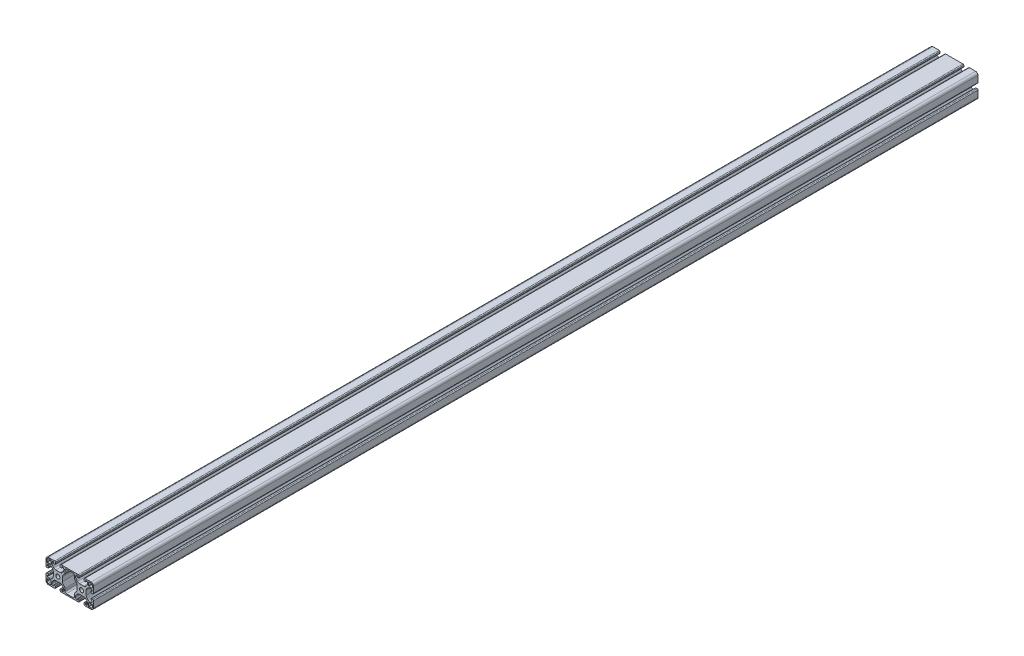
from build123d import *

# Parameters (mm, degrees)
ESQUISSE1_R        = 3.4
BOSS_EXTRU_1_DEPTH = 1492


with BuildPart() as part:
    # Esquisse1 → Boss.-Extru.1 (new body)
    with BuildSketch(Plane.XY.offset(20)):
        with BuildLine():
            Line((66.5, 4.5), (65, 4.5))
            ThreePointArc((65, 4.5), (64.292893219, 4.207106781), (64, 3.5))
            Line((64, 3.5), (64, 1.5))
            ThreePointArc((64, 1.5), (64.439339828, 0.439339828), (65.5, 0))
            Line((65.5, 0), (76, 0))
            ThreePointArc((76, 0), (78.828427125, 1.171572875), (80, 4))
            Line((80, 4), (80, 14.5))
            ThreePointArc((80, 14.5), (79.560660172, 15.560660172), (78.5, 16))
            Line((78.5, 16), (76.5, 16))
            ThreePointArc((76.5, 16), (75.792893219, 15.707106781), (75.5, 15))
            Line((75.5, 15), (75.5, 13.5))
            ThreePointArc((75.5, 13.5), (75.646446609, 13.146446609), (76, 13))
            Line((76, 13), (77.5, 13))
            ThreePointArc((77.5, 13), (77.853553391, 12.853553391), (78, 12.5))
            ThreePointArc((78, 12.5), (77.267766953, 10.732233047), (75.5, 10))
            Line((75.5, 10), (74.192388155, 10))
            ThreePointArc((74.192388155, 10), (72.278970994, 10.380602337), (70.656854249, 11.464466094))
            Line((70.656854249, 11.464466094), (69.214466094, 12.906854249))
            ThreePointArc((69.214466094, 12.906854249), (68.130602337, 14.528970994), (67.75, 16.442388155))
            Line((67.75, 16.442388155), (67.75, 23.557611845))
            ThreePointArc((67.75, 23.557611845), (68.130602337, 25.471029006), (69.214466094, 27.093145751))
            Line((69.214466094, 27.093145751), (70.656854249, 28.535533906))
            ThreePointArc((70.656854249, 28.535533906), (72.278970994, 29.619397663), (74.192388155, 30))
            Line((74.192388155, 30), (75.5, 30))
            ThreePointArc((75.5, 30), (77.267766953, 29.267766953), (78, 27.5))
            ThreePointArc((78, 27.5), (77.853553391, 27.146446609), (77.5, 27))
            Line((77.5, 27), (76, 27))
            ThreePointArc((76, 27), (75.646446609, 26.853553391), (75.5, 26.5))
            Line((75.5, 26.5), (75.5, 25))
            ThreePointArc((75.5, 25), (75.792893219, 24.292893219), (76.5, 24))
            Line((76.5, 24), (78.5, 24))
            ThreePointArc((78.5, 24), (79.560660172, 24.439339828), (80, 25.5))
            Line((80, 25.5), (80, 36))
            ThreePointArc((80, 36), (78.828427125, 38.828427125), (76, 40))
            Line((76, 40), (65.5, 40))
            ThreePointArc((65.5, 40), (64.439339828, 39.560660172), (64, 38.5))
            Line((64, 38.5), (64, 36.5))
            ThreePointArc((64, 36.5), (64.292893219, 35.792893219), (65, 35.5))
            Line((65, 35.5), (66.5, 35.5))
            ThreePointArc((66.5, 35.5), (66.853553391, 35.646446609), (67, 36))
            Line((67, 36), (67, 37.5))
            ThreePointArc((67, 37.5), (67.146446609, 37.853553391), (67.5, 38))
            ThreePointArc((67.5, 38), (69.267766953, 37.267766953), (70, 35.5))
            Line((70, 35.5), (70, 34.192388155))
            ThreePointArc((70, 34.192388155), (69.619397663, 32.278970994), (68.535533906, 30.656854249))
            Line((68.535533906, 30.656854249), (67.093145751, 29.214466094))
            ThreePointArc((67.093145751, 29.214466094), (65.471029006, 28.130602337), (63.557611845, 27.75))
            Line((63.557611845, 27.75), (56.442388155, 27.75))
            ThreePointArc((56.442388155, 27.75), (54.528970994, 28.130602337), (52.906854249, 29.214466094))
            Line((52.906854249, 29.214466094), (51.464466094, 30.656854249))
            ThreePointArc((51.464466094, 30.656854249), (50.380602337, 32.278970994), (50, 34.192388155))
            Line((50, 34.192388155), (50, 35.5))
            ThreePointArc((50, 35.5), (50.732233047, 37.267766953), (52.5, 38))
            ThreePointArc((52.5, 38), (52.853553391, 37.853553391), (53, 37.5))
            Line((53, 37.5), (53, 36))
            ThreePointArc((53, 36), (53.146446609, 35.646446609), (53.5, 35.5))
            Line((53.5, 35.5), (55, 35.5))
            ThreePointArc((55, 35.5), (55.707106781, 35.792893219), (56, 36.5))
            Line((56, 36.5), (56, 38.5))
            ThreePointArc((56, 38.5), (55.560660172, 39.560660172), (54.5, 40))
            Line((54.5, 40), (25.5, 40))
            ThreePointArc((25.5, 40), (24.439339828, 39.560660172), (24, 38.5))
            Line((24, 38.5), (24, 36.5))
            ThreePointArc((24, 36.5), (24.292893219, 35.792893219), (25, 35.5))
            Line((25, 35.5), (26.5, 35.5))
            ThreePointArc((26.5, 35.5), (26.853553391, 35.646446609), (27, 36))
            Line((27, 36), (27, 37.5))
            ThreePointArc((27, 37.5), (27.146446609, 37.853553391), (27.5, 38))
            ThreePointArc((27.5, 38), (29.267766953, 37.267766953), (30, 35.5))
            Line((30, 35.5), (30, 34.192388155))
            ThreePointArc((30, 34.192388155), (29.619397663, 32.278970994), (28.535533906, 30.656854249))
            Line((28.535533906, 30.656854249), (27.093145751, 29.214466094))
            ThreePointArc((27.093145751, 29.214466094), (25.471029006, 28.130602337), (23.557611845, 27.75))
            Line((23.557611845, 27.75), (16.442388155, 27.75))
            ThreePointArc((16.442388155, 27.75), (14.528970994, 28.130602337), (12.906854249, 29.214466094))
            Line((12.906854249, 29.214466094), (11.464466094, 30.656854249))
            ThreePointArc((11.464466094, 30.656854249), (10.380602337, 32.278970994), (10, 34.192388155))
            Line((10, 34.192388155), (10, 35.5))
            ThreePointArc((10, 35.5), (10.732233047, 37.267766953), (12.5, 38))
            ThreePointArc((12.5, 38), (12.853553391, 37.853553391), (13, 37.5))
            Line((13, 37.5), (13, 36))
            ThreePointArc((13, 36), (13.146446609, 35.646446609), (13.5, 35.5))
            Line((13.5, 35.5), (15, 35.5))
            ThreePointArc((15, 35.5), (15.707106781, 35.792893219), (16, 36.5))
            Line((16, 36.5), (16, 38.5))
            ThreePointArc((16, 38.5), (15.560660172, 39.560660172), (14.5, 40))
            Line((14.5, 40), (4, 40))
            ThreePointArc((4, 40), (1.171572875, 38.828427125), (0, 36))
            Line((0, 36), (0, 25.5))
            ThreePointArc((0, 25.5), (0.439339828, 24.439339828), (1.5, 24))
            Line((1.5, 24), (3.5, 24))
            ThreePointArc((3.5, 24), (4.207106781, 24.292893219), (4.5, 25))
            Line((4.5, 25), (4.5, 26.5))
            ThreePointArc((4.5, 26.5), (4.353553391, 26.853553391), (4, 27))
            Line((4, 27), (2.5, 27))
            ThreePointArc((2.5, 27), (2.146446609, 27.146446609), (2, 27.5))
            ThreePointArc((2, 27.5), (2.732233047, 29.267766953), (4.5, 30))
            Line((4.5, 30), (5.807611845, 30))
            ThreePointArc((5.807611845, 30), (7.721029006, 29.619397663), (9.343145751, 28.535533906))
            Line((9.343145751, 28.535533906), (10.785533906, 27.093145751))
            ThreePointArc((10.785533906, 27.093145751), (11.869397663, 25.471029006), (12.25, 23.557611845))
            Line((12.25, 23.557611845), (12.25, 16.442388155))
            ThreePointArc((12.25, 16.442388155), (11.869397663, 14.528970994), (10.785533906, 12.906854249))
            Line((10.785533906, 12.906854249), (9.343145751, 11.464466094))
            ThreePointArc((9.343145751, 11.464466094), (7.721029006, 10.380602337), (5.807611845, 10))
            Line((5.807611845, 10), (4.5, 10))
            ThreePointArc((4.5, 10), (2.732233047, 10.732233047), (2, 12.5))
            ThreePointArc((2, 12.5), (2.146446609, 12.853553391), (2.5, 13))
            Line((2.5, 13), (4, 13))
            ThreePointArc((4, 13), (4.353553391, 13.146446609), (4.5, 13.5))
            Line((4.5, 13.5), (4.5, 15))
            ThreePointArc((4.5, 15), (4.207106781, 15.707106781), (3.5, 16))
            Line((3.5, 16), (1.5, 16))
            ThreePointArc((1.5, 16), (0.439339828, 15.560660172), (0, 14.5))
            Line((0, 14.5), (0, 4))
            ThreePointArc((0, 4), (1.171572875, 1.171572875), (4, 0))
            Line((4, 0), (14.5, 0))
            ThreePointArc((14.5, 0), (15.560660172, 0.439339828), (16, 1.5))
            Line((16, 1.5), (16, 3.5))
            ThreePointArc((16, 3.5), (15.707106781, 4.207106781), (15, 4.5))
            Line((15, 4.5), (13.5, 4.5))
            ThreePointArc((13.5, 4.5), (13.146446609, 4.353553391), (13, 4))
            Line((13, 4), (13, 2.5))
            ThreePointArc((13, 2.5), (12.853553391, 2.146446609), (12.5, 2))
            ThreePointArc((12.5, 2), (10.732233047, 2.732233047), (10, 4.5))
            Line((10, 4.5), (10, 5.807611845))
            ThreePointArc((10, 5.807611845), (10.380602337, 7.721029006), (11.464466094, 9.343145751))
            Line((11.464466094, 9.343145751), (12.906854249, 10.785533906))
            ThreePointArc((12.906854249, 10.785533906), (14.528970994, 11.869397663), (16.442388155, 12.25))
            Line((16.442388155, 12.25), (23.557611845, 12.25))
            ThreePointArc((23.557611845, 12.25), (25.471029006, 11.869397663), (27.093145751, 10.785533906))
            Line((27.093145751, 10.785533906), (28.535533906, 9.343145751))
            ThreePointArc((28.535533906, 9.343145751), (29.619397663, 7.721029006), (30, 5.807611845))
            Line((30, 5.807611845), (30, 4.5))
            ThreePointArc((30, 4.5), (29.267766953, 2.732233047), (27.5, 2))
            ThreePointArc((27.5, 2), (27.146446609, 2.146446609), (27, 2.5))
            Line((27, 2.5), (27, 4))
            ThreePointArc((27, 4), (26.853553391, 4.353553391), (26.5, 4.5))
            Line((26.5, 4.5), (25, 4.5))
            ThreePointArc((25, 4.5), (24.292893219, 4.207106781), (24, 3.5))
            Line((24, 3.5), (24, 1.5))
            ThreePointArc((24, 1.5), (24.439339828, 0.439339828), (25.5, 0))
            Line((25.5, 0), (54.5, 0))
            ThreePointArc((54.5, 0), (55.560660172, 0.439339828), (56, 1.5))
            Line((56, 1.5), (56, 3.5))
            ThreePointArc((56, 3.5), (55.707106781, 4.207106781), (55, 4.5))
            Line((55, 4.5), (53.5, 4.5))
            ThreePointArc((53.5, 4.5), (53.146446609, 4.353553391), (53, 4))
            Line((53, 4), (53, 2.5))
            ThreePointArc((53, 2.5), (52.853553391, 2.146446609), (52.5, 2))
            ThreePointArc((52.5, 2), (50.732233047, 2.732233047), (50, 4.5))
            Line((50, 4.5), (50, 5.807611845))
            ThreePointArc((50, 5.807611845), (50.380602337, 7.721029006), (51.464466094, 9.343145751))
            Line((51.464466094, 9.343145751), (52.906854249, 10.785533906))
            ThreePointArc((52.906854249, 10.785533906), (54.528970994, 11.869397663), (56.442388155, 12.25))
            Line((56.442388155, 12.25), (63.557611845, 12.25))
            ThreePointArc((63.557611845, 12.25), (65.471029006, 11.869397663), (67.093145751, 10.785533906))
            Line((67.093145751, 10.785533906), (68.535533906, 9.343145751))
            ThreePointArc((68.535533906, 9.343145751), (69.619397663, 7.721029006), (70, 5.807611845))
            Line((70, 5.807611845), (70, 4.5))
            ThreePointArc((70, 4.5), (69.267766953, 2.732233047), (67.5, 2))
            ThreePointArc((67.5, 2), (67.146446609, 2.146446609), (67, 2.5))
            Line((67, 2.5), (67, 4))
            ThreePointArc((67, 4), (66.853553391, 4.353553391), (66.5, 4.5))
        make_face()
        with Locations(Location((20, 20, 0), (0, 0, 180))):
            Circle(ESQUISSE1_R, mode=Mode.SUBTRACT)
        with Locations(Location((60, 20, 0), (0, 0, 180))):
            Circle(ESQUISSE1_R, mode=Mode.SUBTRACT)
        with BuildLine():
            Line((31.8, 4.5), (31.8, 8.250252532))
            ThreePointArc((31.8, 8.250252532), (31.419397663, 10.163669694), (30.335533906, 11.785786438))
            Line((30.335533906, 11.785786438), (29.214466094, 12.906854249))
            ThreePointArc((29.214466094, 12.906854249), (28.130602337, 14.528970994), (27.75, 16.442388155))
            Line((27.75, 16.442388155), (27.75, 23.557611845))
            ThreePointArc((27.75, 23.557611845), (28.130602337, 25.471029006), (29.214466094, 27.093145751))
            Line((29.214466094, 27.093145751), (30.335533906, 28.214213562))
            ThreePointArc((30.335533906, 28.214213562), (31.419397663, 29.836330306), (31.8, 31.749747468))
            Line((31.8, 31.749747468), (31.8, 35.5))
            ThreePointArc((31.8, 35.5), (32.532233047, 37.267766953), (34.3, 38))
            Line((34.3, 38), (45.7, 38))
            ThreePointArc((45.7, 38), (47.467766953, 37.267766953), (48.2, 35.5))
            Line((48.2, 35.5), (48.2, 31.749747468))
            ThreePointArc((48.2, 31.749747468), (48.580602337, 29.836330306), (49.664466094, 28.214213562))
            Line((49.664466094, 28.214213562), (50.785533906, 27.093145751))
            ThreePointArc((50.785533906, 27.093145751), (51.869397663, 25.471029006), (52.25, 23.557611845))
            Line((52.25, 23.557611845), (52.25, 16.442388155))
            ThreePointArc((52.25, 16.442388155), (51.869397663, 14.528970994), (50.785533906, 12.906854249))
            Line((50.785533906, 12.906854249), (49.664466094, 11.785786438))
            ThreePointArc((49.664466094, 11.785786438), (48.580602337, 10.163669694), (48.2, 8.250252532))
            Line((48.2, 8.250252532), (48.2, 4.5))
            ThreePointArc((48.2, 4.5), (47.467766953, 2.732233047), (45.7, 2))
            Line((45.7, 2), (34.3, 2))
            ThreePointArc((34.3, 2), (32.532233047, 2.732233047), (31.8, 4.5))
        make_face(mode=Mode.SUBTRACT)
        with BuildLine():
            Line((7.7, 1.8), (4, 1.8))
            ThreePointArc((4, 1.8), (2.444365081, 2.444365081), (1.8, 4))
            Line((1.8, 4), (1.8, 7.7))
            ThreePointArc((1.8, 7.7), (1.946446609, 8.053553391), (2.3, 8.2))
            Line((2.3, 8.2), (7.7, 8.2))
            ThreePointArc((7.7, 8.2), (8.053553391, 8.053553391), (8.2, 7.7))
            Line((8.2, 7.7), (8.2, 2.3))
            ThreePointArc((8.2, 2.3), (8.053553391, 1.946446609), (7.7, 1.8))
        make_face(mode=Mode.SUBTRACT)
        with BuildLine():
            Line((72.3, 38.2), (76, 38.2))
            ThreePointArc((76, 38.2), (77.555634919, 37.555634919), (78.2, 36))
            Line((78.2, 36), (78.2, 32.3))
            ThreePointArc((78.2, 32.3), (78.053553391, 31.946446609), (77.7, 31.8))
            Line((77.7, 31.8), (72.3, 31.8))
            ThreePointArc((72.3, 31.8), (71.946446609, 31.946446609), (71.8, 32.3))
            Line((71.8, 32.3), (71.8, 37.7))
            ThreePointArc((71.8, 37.7), (71.946446609, 38.053553391), (72.3, 38.2))
        make_face(mode=Mode.SUBTRACT)
        with BuildLine():
            Line((78.2, 7.7), (78.2, 4))
            ThreePointArc((78.2, 4), (77.555634919, 2.444365081), (76, 1.8))
            Line((76, 1.8), (72.3, 1.8))
            ThreePointArc((72.3, 1.8), (71.946446609, 1.946446609), (71.8, 2.3))
            Line((71.8, 2.3), (71.8, 7.7))
            ThreePointArc((71.8, 7.7), (71.946446609, 8.053553391), (72.3, 8.2))
            Line((72.3, 8.2), (77.7, 8.2))
            ThreePointArc((77.7, 8.2), (78.053553391, 8.053553391), (78.2, 7.7))
        make_face(mode=Mode.SUBTRACT)
        with BuildLine():
            Line((1.8, 32.3), (1.8, 36))
            ThreePointArc((1.8, 36), (2.444365081, 37.555634919), (4, 38.2))
            Line((4, 38.2), (7.7, 38.2))
            ThreePointArc((7.7, 38.2), (8.053553391, 38.053553391), (8.2, 37.7))
            Line((8.2, 37.7), (8.2, 32.3))
            ThreePointArc((8.2, 32.3), (8.053553391, 31.946446609), (7.7, 31.8))
            Line((7.7, 31.8), (2.3, 31.8))
            ThreePointArc((2.3, 31.8), (1.946446609, 31.946446609), (1.8, 32.3))
        make_face(mode=Mode.SUBTRACT)
    extrude(amount=-BOSS_EXTRU_1_DEPTH)


solid = part.part
